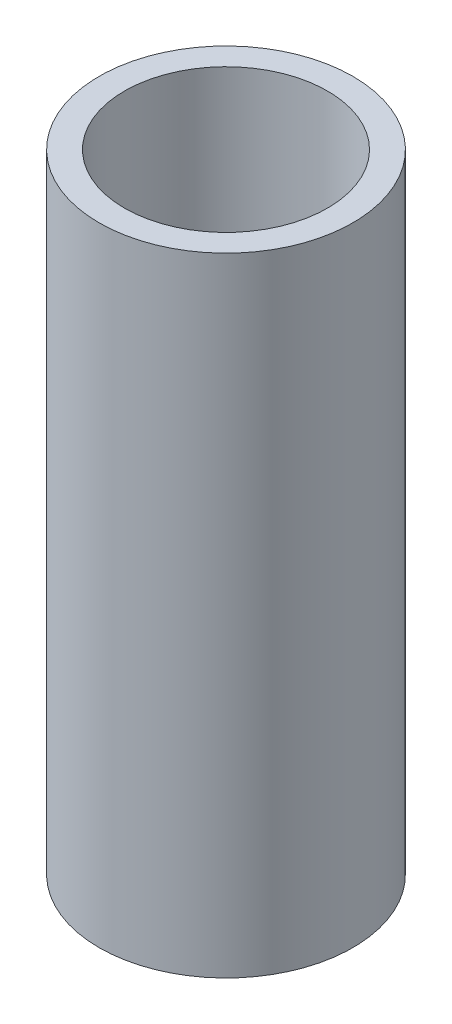
from build123d import *

# Parameters (mm, degrees)
SKETCH1_W = 0.38
SKETCH1_H = 9.4


with BuildPart() as part:
    # Sketch1 → Revolve1 (revolve)
    with BuildSketch(Plane.XY, mode=Mode.PRIVATE) as revolve1_sk:
        with Locations((1.71, 4.7)):
            Rectangle(SKETCH1_W, SKETCH1_H)
    revolve(revolve1_sk.sketch.rotate(Axis((0, 0, 0), (0, 1, 0)), 270), axis=Axis((0, 0, 0), (0, 1, 0)))


solid = part.part
